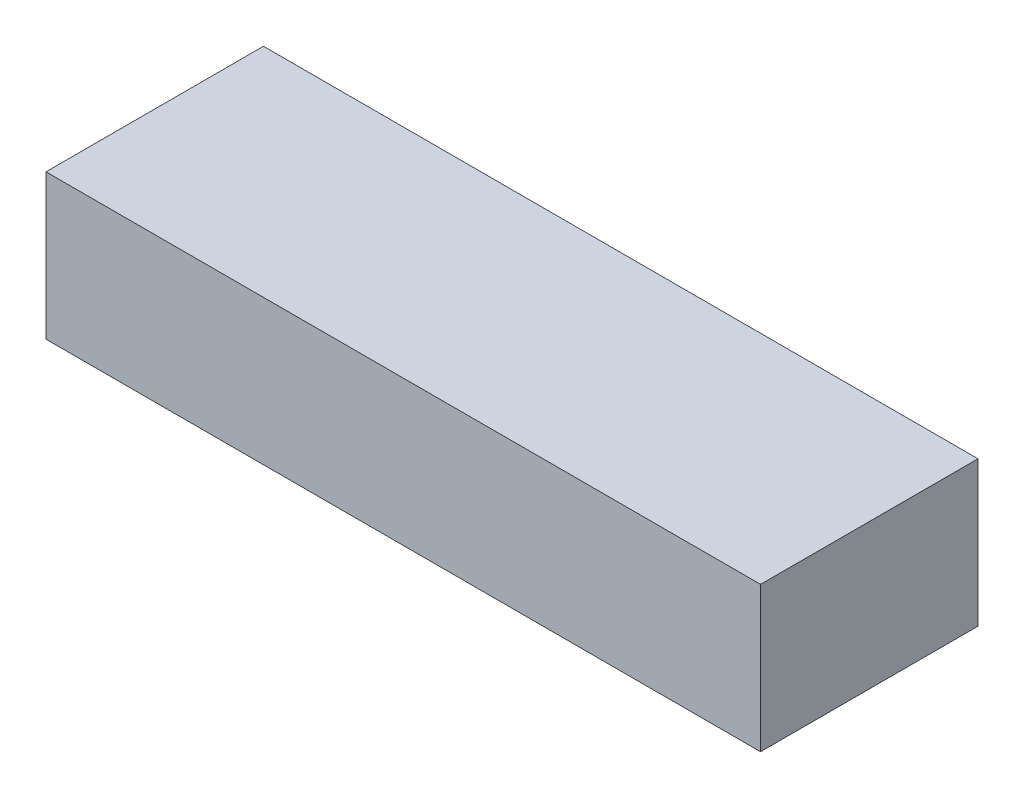
from build123d import *

# Parameters (mm, degrees)
SKETCH1_W           = 138
SKETCH1_H           = 42
BOSS_EXTRUDE1_DEPTH = 28
BOSS_EXTRUDE2_START = -14
BOSS_EXTRUDE2_DEPTH = 105


with BuildPart() as part:
    # Sketch1 → Boss-Extrude1 (new body)
    with BuildSketch(Plane(origin=(0, 0, 0), x_dir=(1, 0, 0), z_dir=(0, 1, 0))):
        Rectangle(SKETCH1_W, SKETCH1_H)
    extrude(amount=BOSS_EXTRUDE1_DEPTH)

    # Sketch3 → Boss-Extrude2 (add)
    with BuildSketch(Plane(origin=(69, 0, 0), x_dir=(0, 0, -1), z_dir=(1, 0, 0)).offset(BOSS_EXTRUDE2_START)):
        Polygon((-15, -5), (15, -5), (10, 0), (-10, 0), align=None)
    extrude(amount=-BOSS_EXTRUDE2_DEPTH)


solid = part.part
